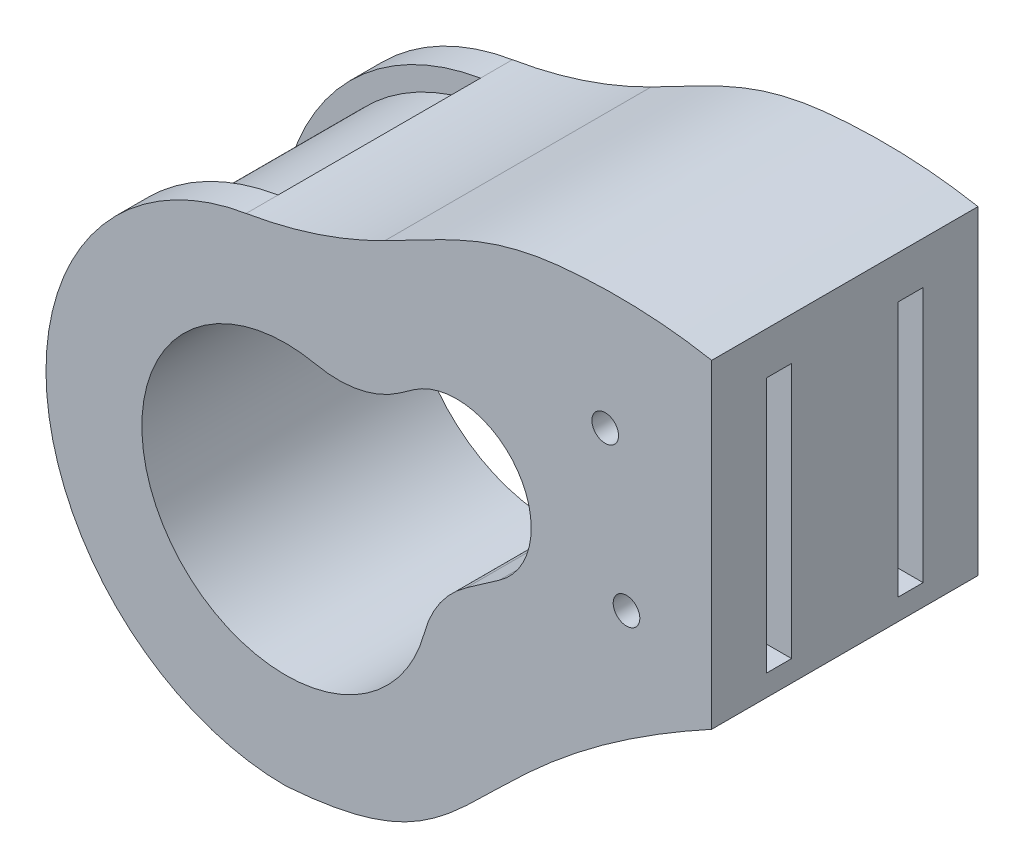
from build123d import *

# Parameters (mm, degrees)
BOSS_EXTRUDE1_DEPTH            = 25
SKETCH2_W                      = 2.35
SKETCH2_H                      = 24
CUT_EXTRUDE1_DEPTH             = 23
SKETCH3_R                      = 1.25
CUT_EXTRUDE2_DEPTH             = 58.509648628
CUT_EXTRUDE3_DEPTH             = 58.509648628
CUT_EXTRUDE5_START             = -22
CUT_EXTRUDE5_DEPTH             = 19
CUT_EXTRUDE6_REACH             = 67.815
CUT_EXTRUDE6_END_RADIUS        = 13.5
SKETCH9_W                      = 2.7
SKETCH9_H                      = 13
CUT_EXTRUDE7_REACH             = 67.138
SKETCH10_W                     = 2.7
SKETCH10_H                     = 13
CUT_EXTRUDE7_DIRECTION_2_REACH = 67.138
CUT_EXTRUDE8_DEPTH             = 1.5


with BuildPart() as part:
    # Sketch1 → Boss-Extrude1 (new body)
    with BuildSketch(Plane.XY):
        with BuildLine():
            Line((40, 2.101809534), (40, 32.101809534))
            add(Edge.make_bspline(
                [(40, 32.101809534), (34.329847466, 33.163229144), (26.982496241, 32.840779877), (18.572888448, 31.653354862), (14.859267804, 29.312585721), (9.310772029, 26.484528724)],
                knots=[0, 0, 0, 0, 0.184099436, 0.268179873, 0.840804373, 0.840804373, 0.840804373, 0.840804373], degree=3))
            ThreePointArc((9.310772029, 26.484528724), (2.965735487, 23.839790418), (-3.708097079, 22.192341383))
            ThreePointArc((-3.708097079, 22.192341383), (-22.422953431, -1.860419158), (0, -22.5))
            add(Edge.make_bspline(
                [(40, 2.101809534), (14.753998058, -11.692085759), (19.320151725, -21.091052748), (0, -22.5)],
                knots=[0, 0, 0, 0, 1, 1, 1, 1], degree=3))
        make_face()
    extrude(amount=BOSS_EXTRUDE1_DEPTH)

    # Sketch2 → Cut-Extrude1 (cut)
    with BuildSketch(Plane(origin=(40, 0, 0), x_dir=(0, 0, -1), z_dir=(1, 0, 0))):
        with Locations((-18.675, 16.101809534)):
            Rectangle(SKETCH2_W, SKETCH2_H)
        with Locations((-6.325, 16.101809534)):
            Rectangle(SKETCH2_W, SKETCH2_H)
    extrude(amount=-CUT_EXTRUDE1_DEPTH, mode=Mode.SUBTRACT)

    # Sketch3 → Cut-Extrude2 (cut, through all)
    with BuildSketch(Plane.XY.offset(25)):
        with Locations((30, 21.601809534)):
            Circle(SKETCH3_R)
        with Locations((32, 7.745403073)):
            Circle(SKETCH3_R)
    extrude(amount=-CUT_EXTRUDE2_DEPTH, mode=Mode.SUBTRACT)

    # Sketch4 → Cut-Extrude3 (cut, through all)
    with BuildSketch(Plane.XY.offset(25)):
        with BuildLine():
            Line((10.671834965, 14.77707476), (12.04378968, 15.735776262))
            ThreePointArc((12.04378968, 15.735776262), (21.791242729, 14.007436293), (20.062902761, 4.259983244))
            Line((20.062902761, 4.259983244), (16.966325256, 2.096141048))
            ThreePointArc((16.966325256, 2.096141048), (14.507836146, -0.357822313), (13.037129907, -3.504745895))
            ThreePointArc((13.037129907, -3.504745895), (-11.522414618, -7.034483732), (2.840111071, 13.19786987))
            ThreePointArc((2.840111071, 13.19786987), (6.920533419, 13.171370724), (10.671834965, 14.77707476))
        make_face()
    extrude(amount=-CUT_EXTRUDE3_DEPTH, mode=Mode.SUBTRACT)

    # Sketch6 → Cut-Extrude5 (cut)
    with BuildSketch(Plane.XY.offset(25).offset(CUT_EXTRUDE5_START)):
        with BuildLine():
            Line((-3.708097079, 22.192341383), (-3.378488449, 20.219688816))
            ThreePointArc((-3.378488449, 20.219688816), (-20.432738232, -1.659279471), (-0.071778676, -20.499874337))
            add(Edge.make_bspline(
                [(-0.071778676, -20.499874337), (0.208558967, -20.479056775), (0.777070886, -20.432379755), (1.847267067, -20.326496662), (3.108426982, -20.167703365), (4.494156168, -19.937504643), (6.189724602, -19.579509646), (8.047092499, -19.040626432), (9.948281947, -18.257182138), (11.622649285, -17.334955593), (13.684671017, -15.901647803), (15.442310851, -14.323635678), (16.949424963, -12.863739279), (17.392469361, -12.430339701), (17.53347875, -12.292192277)],
                knots=[0.001319104, 0.001319104, 0.001319104, 0.001319104, 0.016708897, 0.03209869, 0.062878276, 0.093657862, 0.124437448, 0.185996621, 0.247555793, 0.309114965, 0.370674138, 0.493792482, 0.527315904, 0.542705697, 0.542705697, 0.542705697, 0.542705697], degree=3))
            Line((17.53347875, -12.292192277), (18.933119987, -13.720829532))
            add(Edge.make_bspline(
                [(0, -22.5), (10.485156415, -21.735356299), (13.935091868, -18.617416288), (18.933119987, -13.720829532)],
                knots=[0, 0, 0, 0, 0.542705697, 0.542705697, 0.542705697, 0.542705697], degree=3))
            ThreePointArc((0, -22.5), (-22.422953431, -1.860419158), (-3.708097079, 22.192341383))
        make_face()
    extrude(amount=CUT_EXTRUDE5_DEPTH, mode=Mode.SUBTRACT)

    # Cut-Extrude6: up to this cylinder (the profile starts outside it)
    cut_extrude6_end = Plane(origin=(0, 0, 12.5), z_dir=(0, 0, 1)) * Cylinder(CUT_EXTRUDE6_END_RADIUS, 163.63, mode=Mode.PRIVATE)
    # Sketch9 → Cut-Extrude6 (cut, up to the surface)
    with BuildSketch(Plane(origin=(-3.378488449, 20.219688816, 0), x_dir=(0.9863262836854494, 0.16480431460144024, 0), z_dir=(-0.16480431460144024, 0.9863262836854494, 0)), mode=Mode.PRIVATE) as cut_extrude6_sk1:
        with Locations((-1.35, -12.5)):
            Rectangle(SKETCH9_W, SKETCH9_H)
    cut_extrude6_tool1 = extrude(cut_extrude6_sk1.sketch, amount=-CUT_EXTRUDE6_REACH, mode=Mode.PRIVATE) - cut_extrude6_end
    add(cut_extrude6_tool1.solids().sort_by_distance((-4.710029, 19.997203, 12.5))[0], mode=Mode.SUBTRACT)

    # Sketch10 → Cut-Extrude7 (cut, up to next)
    with BuildSketch(Plane(origin=(14.346322684, -14.643531864, 0), x_dir=(-0.7143186274909935, -0.6998206187441061, 0), z_dir=(0.6998206187441061, -0.7143186274909935, 0)), mode=Mode.PRIVATE) as cut_extrude7_sk1:
        with Locations((-2.57216087, -12.5)):
            Rectangle(SKETCH10_W, SKETCH10_H)
    cut_extrude7_tool1 = extrude(cut_extrude7_sk1.sketch, amount=-CUT_EXTRUDE7_REACH, mode=Mode.PRIVATE) & part.part
    add(cut_extrude7_tool1.solids().sort_by_distance((16.183665, -12.843481, 12.5))[0], mode=Mode.SUBTRACT)

    # Sketch10 → Cut-Extrude7 direction 2 (cut, up to next)
    with BuildSketch(Plane(origin=(14.346322684, -14.643531864, 0), x_dir=(-0.7143186274909935, -0.6998206187441061, 0), z_dir=(0.6998206187441061, -0.7143186274909935, 0)), mode=Mode.PRIVATE) as cut_extrude7_direction_2_sk1:
        with Locations((-2.57216087, -12.5)):
            Rectangle(SKETCH10_W, SKETCH10_H)
    cut_extrude7_direction_2_tool1 = extrude(cut_extrude7_direction_2_sk1.sketch, amount=CUT_EXTRUDE7_DIRECTION_2_REACH, mode=Mode.PRIVATE) & part.part
    add(cut_extrude7_direction_2_tool1.solids().sort_by_distance((16.183665, -12.843481, 12.5))[0], mode=Mode.SUBTRACT)

    # Sketch13 → Cut-Extrude8 (cut)
    with BuildSketch(Plane(origin=(0, 0, 0), x_dir=(-1, 0, 0), z_dir=(0, 0, -1))):
        Polygon((-27.75, 20.302771428), (-27.75, 22.900847639), (-30, 24.199885745), (-32.25, 22.900847639), (-32.25, 20.302771428), (-30, 19.003733322), align=None)
        Polygon((-29.75, 9.044441179), (-32, 10.343479284), (-34.25, 9.044441179), (-34.25, 6.446364967), (-32, 5.147326862), (-29.75, 6.446364967), align=None)
    extrude(amount=-CUT_EXTRUDE8_DEPTH, mode=Mode.SUBTRACT)


solid = part.part
